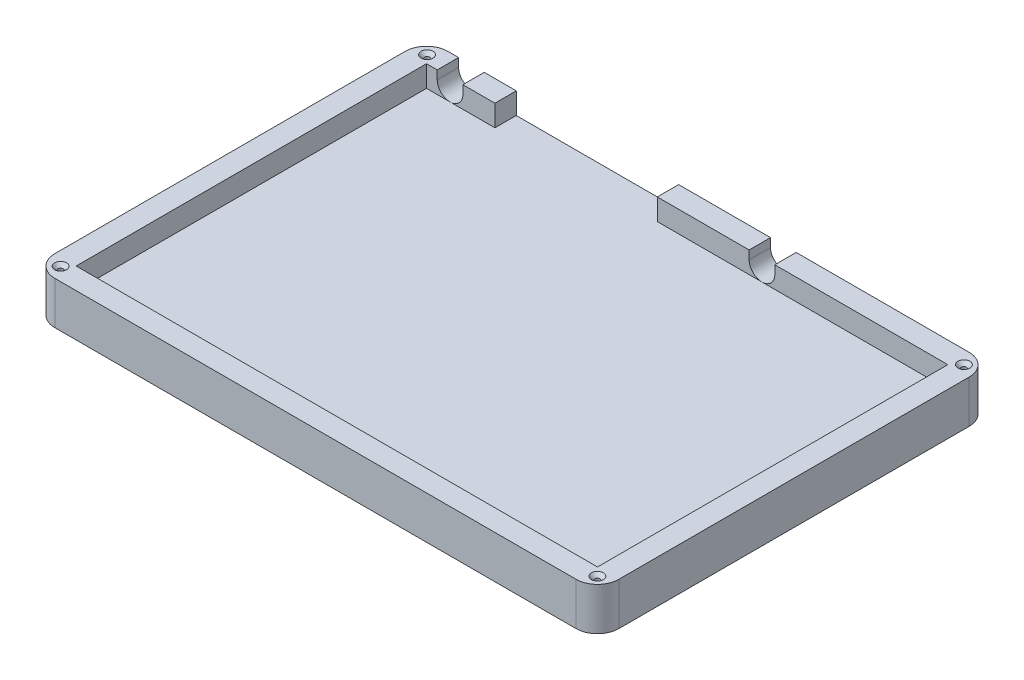
from build123d import *

# Parameters (mm, degrees)
SKETCH2_W                       = 122
SKETCH2_H                       = 82
BOSS_EXTRUDE1_DEPTH             = 5
SKETCH2_3_W                     = 122
SKETCH2_3_H                     = 82
BOSS_EXTRUDE2_DEPTH             = 10
F_0_80_TAPPED_HOLE1_D           = 1.19126
F_0_80_TAPPED_HOLE1_DEPTH       = 3.642109389
F_0_80_TAPPED_HOLE1_CSINK_D     = 2.794
F_0_80_TAPPED_HOLE1_CSINK_ANGLE = 90
F_0_80_TAPPED_HOLE1_TIP         = 0.357890611
SKETCH8_W                       = 38
SKETCH8_H                       = 5
CUT_EXTRUDE1_DEPTH              = 5
CUT_EXTRUDE2_DEPTH              = 5
CUT_EXTRUDE3_DEPTH              = 5


with BuildPart() as part:
    # Sketch2 → Boss-Extrude1 (new body)
    # profile 1 of 2: a face of its own
    with BuildSketch(Plane(origin=(0, 0, 0), x_dir=(1, 0, 0), z_dir=(0, 1, 0))):
        with BuildLine():
            ThreePointArc((-66, 41), (-64.535533906, 44.535533906), (-61, 46))
            Line((-61, 46), (61, 46))
            ThreePointArc((61, 46), (64.535533906, 44.535533906), (66, 41))
            Line((66, 41), (66, -41))
            ThreePointArc((66, -41), (64.535533906, -44.535533906), (61, -46))
            Line((61, -46), (-61, -46))
            ThreePointArc((-61, -46), (-64.535533906, -44.535533906), (-66, -41))
            Line((-66, -41), (-66, 41))
        make_face()
        Rectangle(SKETCH2_W, SKETCH2_H, mode=Mode.SUBTRACT)
    # profile 2 of 2: a face of its own
    with BuildSketch(Plane(origin=(0, 0, 0), x_dir=(1, 0, 0), z_dir=(0, 1, 0))):
        Rectangle(SKETCH2_W, SKETCH2_H)
    extrude(amount=BOSS_EXTRUDE1_DEPTH)

    # Sketch2<3> → Boss-Extrude2 (add)
    with BuildSketch(Plane(origin=(0, 0, 0), x_dir=(1, 0, 0), z_dir=(0, 1, 0))):
        with BuildLine():
            Line((-61, -46), (61, -46))
            ThreePointArc((61, -46), (64.535533906, -44.535533906), (66, -41))
            Line((66, -41), (66, 41))
            ThreePointArc((66, 41), (64.535533906, 44.535533906), (61, 46))
            Line((61, 46), (-61, 46))
            ThreePointArc((-61, 46), (-64.535533906, 44.535533906), (-66, 41))
            Line((-66, 41), (-66, -41))
            ThreePointArc((-66, -41), (-64.535533906, -44.535533906), (-61, -46))
        make_face()
        Rectangle(SKETCH2_3_W, SKETCH2_3_H, mode=Mode.SUBTRACT)
    extrude(amount=BOSS_EXTRUDE2_DEPTH)

    # #0-80 Tapped Hole1
    with Locations(Plane(origin=(62.880041054, 10, -42.889125675), x_dir=(0, 0, 1), z_dir=(0, 1, 0))):
        with Locations((0, 0), (85.769428086, 0), (0, -125.638471979), (85.769428086, -125.638471979)):
            CounterSinkHole(F_0_80_TAPPED_HOLE1_D / 2, F_0_80_TAPPED_HOLE1_CSINK_D / 2, depth=F_0_80_TAPPED_HOLE1_DEPTH, counter_sink_angle=F_0_80_TAPPED_HOLE1_CSINK_ANGLE)
            with Locations((0, 0, -(F_0_80_TAPPED_HOLE1_DEPTH + F_0_80_TAPPED_HOLE1_TIP / 2))):  # 118° drill point
                Cone(0, F_0_80_TAPPED_HOLE1_D / 2, F_0_80_TAPPED_HOLE1_TIP, mode=Mode.SUBTRACT)

    # Sketch8 → Cut-Extrude1 (cut)
    with BuildSketch(Plane(origin=(0, 10, 0), x_dir=(1, 0, 0), z_dir=(0, 1, 0))):
        with Locations((-26, 43.5)):
            Rectangle(SKETCH8_W, SKETCH8_H)
    extrude(amount=-CUT_EXTRUDE1_DEPTH, mode=Mode.SUBTRACT)

    # Sketch9 → Cut-Extrude2 (cut)
    with BuildSketch(Plane(origin=(0, 0, -46), x_dir=(-1, 0, 0), z_dir=(0, 0, -1))):
        with BuildLine():
            Line((-20.5, 10), (-20.5, 8))
            ThreePointArc((-20.5, 8), (-17.5, 5), (-14.5, 8))
            Line((-14.5, 8), (-14.5, 10))
            Line((-14.5, 10), (-20.5, 10))
        make_face()
    extrude(amount=-CUT_EXTRUDE2_DEPTH, mode=Mode.SUBTRACT)

    # Sketch10 → Cut-Extrude3 (cut)
    with BuildSketch(Plane(origin=(0, 0, -46), x_dir=(-1, 0, 0), z_dir=(0, 0, -1))):
        with BuildLine():
            Line((52.5, 10), (52.5, 8))
            ThreePointArc((52.5, 8), (55.5, 5), (58.5, 8))
            Line((58.5, 8), (58.5, 10))
            Line((58.5, 10), (52.5, 10))
        make_face()
    extrude(amount=-CUT_EXTRUDE3_DEPTH, mode=Mode.SUBTRACT)


solid = part.part
